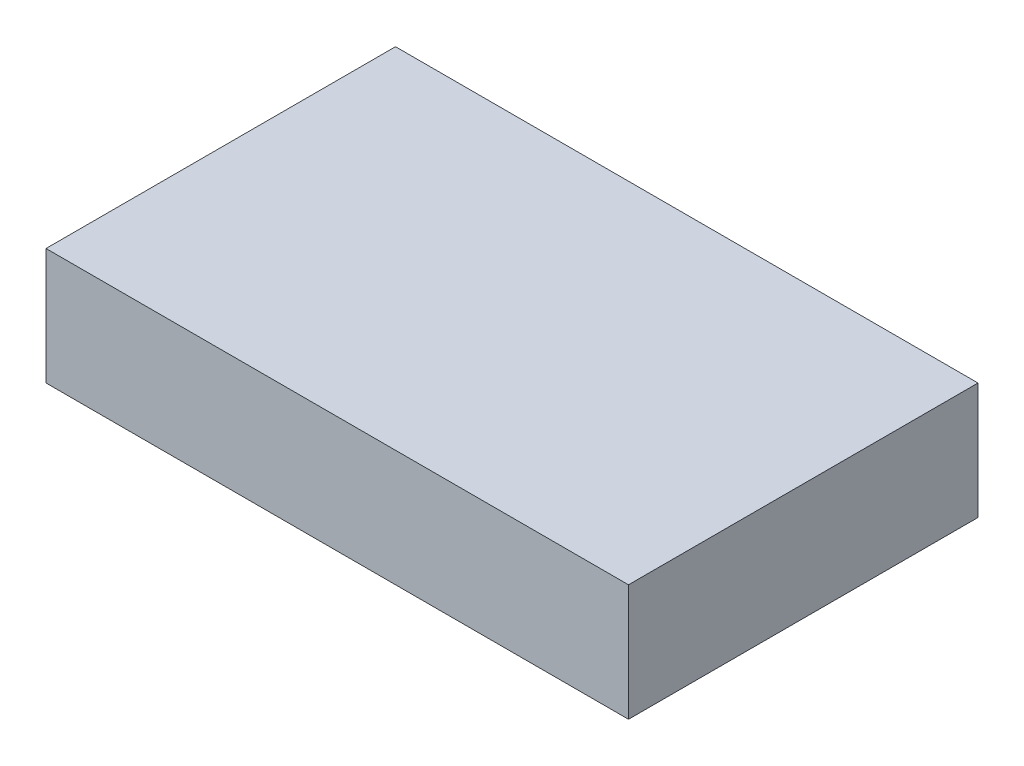
from build123d import *

# Parameters (mm, degrees)
SKIZZE1_W                       = 5000
SKIZZE1_H                       = 3000
AUFSATZ_LINEAR_AUSTRAGEN1_DEPTH = 1000


with BuildPart() as part:
    # Skizze1 → Aufsatz-Linear austragen1 (new body)
    with BuildSketch(Plane(origin=(0, 0, 0), x_dir=(1, 0, 0), z_dir=(0, 1, 0))):
        with Locations((-776.441531607, -330.882352941)):
            Rectangle(SKIZZE1_W, SKIZZE1_H)
    extrude(amount=AUFSATZ_LINEAR_AUSTRAGEN1_DEPTH)


solid = part.part
